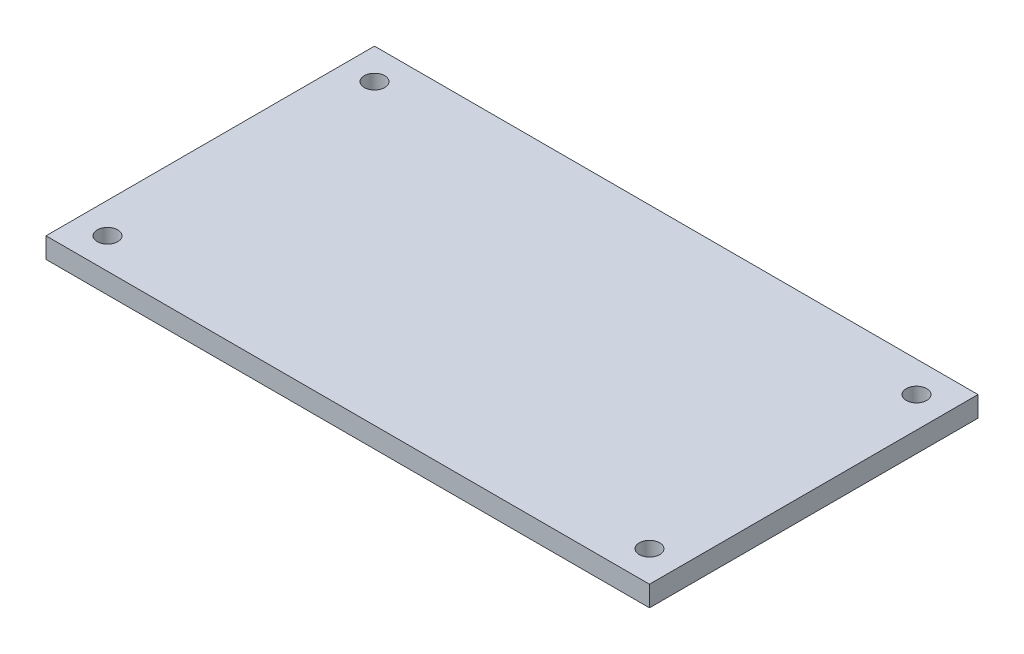
from build123d import *

# Parameters (mm, degrees)
SKETCH1_W           = 58.86
SKETCH1_H           = 32.04
SKETCH1_R           = 1
BOSS_EXTRUDE1_DEPTH = 2


with BuildPart() as part:
    # Sketch1 → Boss-Extrude1 (new body)
    with BuildSketch(Plane(origin=(0, 0, 0), x_dir=(1, 0, 0), z_dir=(0, 1, 0))):
        with Locations((26.43, 13.02)):
            Rectangle(SKETCH1_W, SKETCH1_H)
        with Locations(Location((52.86, 26.04, 0), (0, 0, 270))):
            Circle(SKETCH1_R, mode=Mode.SUBTRACT)
        with Locations(Location((0, 0, 0), (0, 0, 270))):
            Circle(SKETCH1_R, mode=Mode.SUBTRACT)
        with Locations(Location((0, 26.04, 0), (0, 0, 270))):
            Circle(SKETCH1_R, mode=Mode.SUBTRACT)
        with Locations(Location((52.86, 0, 0), (0, 0, 270))):
            Circle(SKETCH1_R, mode=Mode.SUBTRACT)
    extrude(amount=BOSS_EXTRUDE1_DEPTH)


solid = part.part
